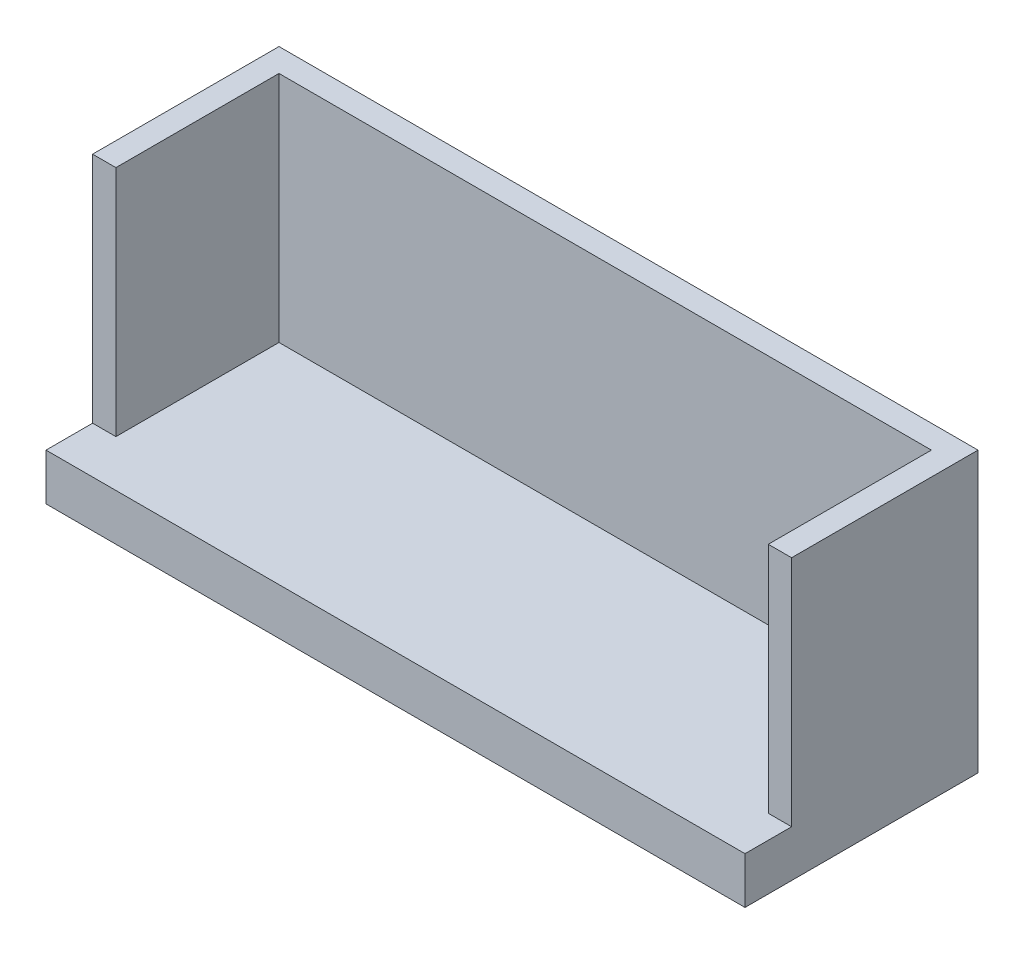
from build123d import *

# Parameters (mm, degrees)
SKETCH_1_W      = 15
SKETCH_1_H      = 5
EXTRUDE_1_DEPTH = 1
EXTRUDE_2_DEPTH = 5


with BuildPart() as part:
    # 草图1 → 凸台-拉伸1 (new body)
    with BuildSketch(Plane(origin=(0, 0, 0), x_dir=(1, 0, 0), z_dir=(0, 1, 0))):
        Rectangle(SKETCH_1_W, SKETCH_1_H)
    extrude(amount=EXTRUDE_1_DEPTH)

    # 草图3 → 凸台-拉伸2 (add)
    with BuildSketch(Plane(origin=(0, 1, 0), x_dir=(1, 0, 0), z_dir=(0, 1, 0))):
        Polygon((-7.5, -1.5), (-7, -1.5), (-7, 2), (7, 2), (7, -1.5), (7.5, -1.5), (7.5, 2.5), (-7.5, 2.5), align=None)
    extrude(amount=EXTRUDE_2_DEPTH)


solid = part.part
